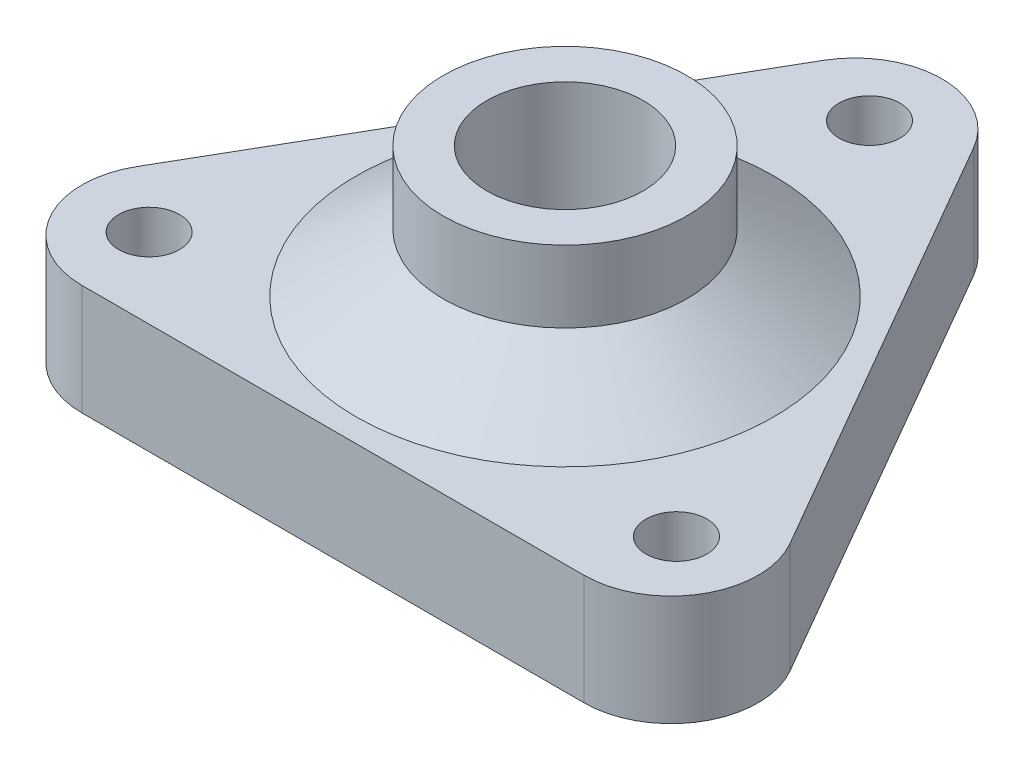
from build123d import *

# Parameters (mm, degrees)
SKETCH1_R           = 1.75
SKETCH1_R_2         = 4.5
BOSS_EXTRUDE1_DEPTH = 6.35
FILLET1_R           = 5
SKETCH2_R           = 7
SKETCH2_R_2         = 4.5
BOSS_EXTRUDE2_DEPTH = 7.5
CHAMFER1_SIZE       = 5
CHAMFER1_SIZE2      = 3.372542584


with BuildPart() as part:
    # Sketch1 → Boss-Extrude1 (new body)
    with BuildSketch(Plane(origin=(0, 0, 0), x_dir=(1, 0, 0), z_dir=(0, 1, 0))):
        Polygon((-23.094010768, -13.333333333), (23.094010768, -13.333333333), (0, 26.666666667), align=None)
        with Locations(Location((0, 17.5, 0), (0, 0, 270))):
            Circle(SKETCH1_R, mode=Mode.SUBTRACT)
        with Locations(Location((-15.155444566, -8.75, 0), (0, 0, 270))):
            Circle(SKETCH1_R, mode=Mode.SUBTRACT)
        with Locations(Location((15.155444566, -8.75, 0), (0, 0, 270))):
            Circle(SKETCH1_R, mode=Mode.SUBTRACT)
        with Locations(Location((0, 0, 0), (0, 0, 270))):
            Circle(SKETCH1_R_2, mode=Mode.SUBTRACT)
    extrude(amount=BOSS_EXTRUDE1_DEPTH)

    # Fillet1
    fillet1_edges = [part.edges().sort_by_distance(p)[0] for p in [
        (-23.094010768, 3.175, 13.333333333),
        (0, 3.175, -26.666666667),
        (23.094010768, 3.175, 13.333333333),
    ]]
    fillet(fillet1_edges, radius=FILLET1_R)

    # Sketch2 → Boss-Extrude2 (add)
    with BuildSketch(Plane(origin=(0, 6.35, 0), x_dir=(1, 0, 0), z_dir=(0, 1, 0))):
        with Locations(Location((0, 0, 0), (0, 0, 270))):
            Circle(SKETCH2_R)
        with Locations(Location((0, 0, 0), (0, 0, 270))):
            Circle(SKETCH2_R_2, mode=Mode.SUBTRACT)
    extrude(amount=BOSS_EXTRUDE2_DEPTH)

    # Chamfer1
    chamfer1_edges = [part.edges().sort_by_distance(p)[0] for p in [
        (0, 6.35, -7),
    ]]
    chamfer1_side = [part.faces().sort_by_distance(p)[0] for p in [
        (0, 6.35, 12.810295705),
    ]]
    chamfer(chamfer1_edges, length=CHAMFER1_SIZE, length2=CHAMFER1_SIZE2, reference=chamfer1_side[0])


solid = part.part
